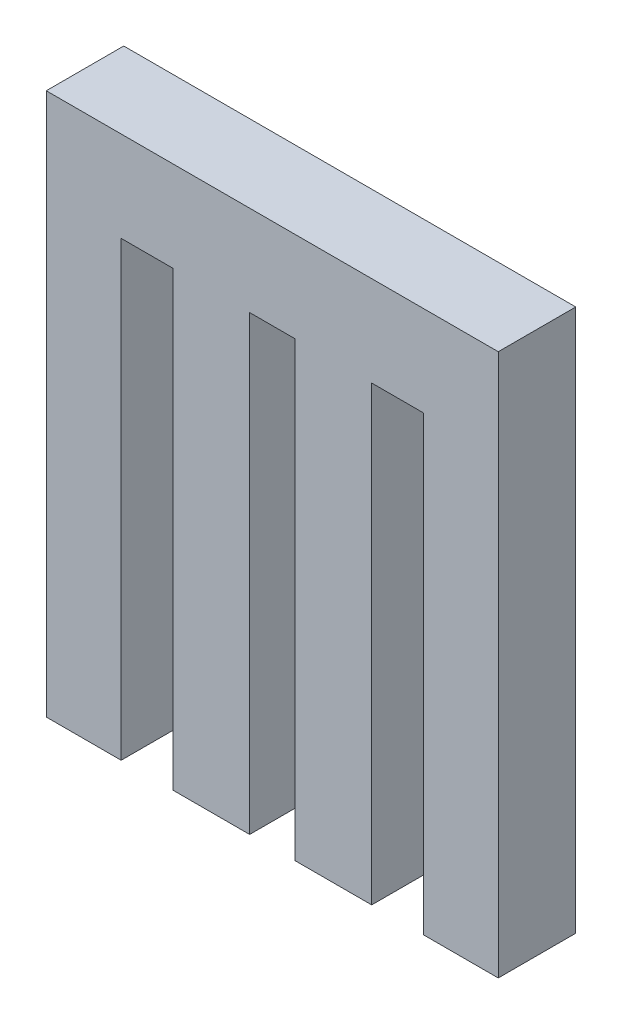
from build123d import *

# Parameters (mm, degrees)
ESQUISSE1_W             = 35
ESQUISSE1_H             = 42
BOSS_EXTRU_1_DEPTH      = 6
ESQUISSE2_W             = 4
ESQUISSE2_H             = 35
ESQUISSE2_W_2           = 3.5
ENL_V_MAT_EXTRU_1_DEPTH = 6


with BuildPart() as part:
    # Esquisse1 → Boss.-Extru.1 (new body)
    with BuildSketch(Plane.XY):
        Rectangle(ESQUISSE1_W, ESQUISSE1_H)
    extrude(amount=BOSS_EXTRU_1_DEPTH)

    # Esquisse2 → Enlèv. mat.-Extru.1 (cut)
    with BuildSketch(Plane(origin=(0, 0, 0), x_dir=(-1, 0, 0), z_dir=(0, 0, -1))):
        with Locations((-9.7, -3.5)):
            Rectangle(ESQUISSE2_W, ESQUISSE2_H)
        with Locations((9.7, -3.5)):
            Rectangle(ESQUISSE2_W, ESQUISSE2_H)
        with Locations((0, -3.5)):
            Rectangle(ESQUISSE2_W_2, ESQUISSE2_H)
    extrude(amount=-ENL_V_MAT_EXTRU_1_DEPTH, mode=Mode.SUBTRACT)


solid = part.part
